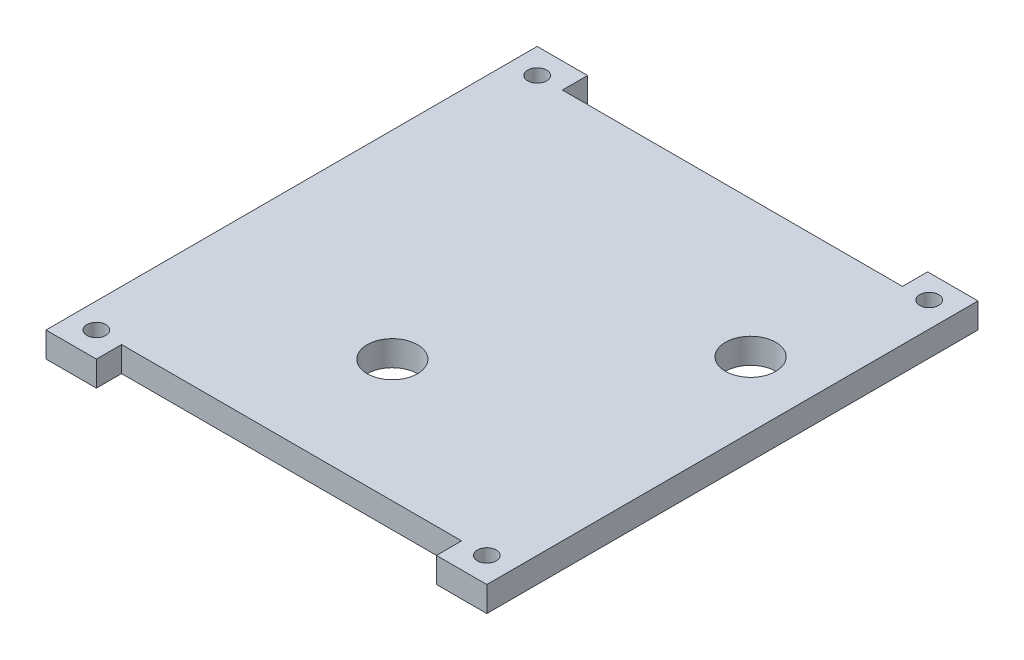
from build123d import *

# Parameters (mm, degrees)
SKETCH1_R           = 0.75
BOSS_EXTRUDE1_DEPTH = 2
SKETCH2_R           = 2
CUT_EXTRUDE1_DEPTH  = 2


with BuildPart() as part:
    # Sketch1 → Boss-Extrude1 (new body)
    with BuildSketch(Plane(origin=(0, 4.390610578, 0), x_dir=(1, 0, 0), z_dir=(0, 1, 0))):
        Polygon((10.961043754, 31.726646364), (10.961043754, -7.273353636), (14.961043754, -7.273353636), (14.961043754, -5.273353636), (41.961043754, -5.273353636), (41.961043754, -7.273353636), (45.961043754, -7.273353636), (45.961043754, 31.726646364), (41.961043754, 31.726646364), (41.961043754, 29.726646364), (14.961043754, 29.726646364), (14.961043754, 31.726646364), align=None)
        with Locations(Location((12.961043754, -5.273353636, 0), (0, 0, 270))):
            Circle(SKETCH1_R, mode=Mode.SUBTRACT)
        with Locations(Location((43.961043754, -5.273353636, 0), (0, 0, 270))):
            Circle(SKETCH1_R, mode=Mode.SUBTRACT)
        with Locations(Location((43.961043754, 29.849185289, 0), (0, 0, 270))):
            Circle(SKETCH1_R, mode=Mode.SUBTRACT)
        with Locations(Location((12.961043754, 29.726646364, 0), (0, 0, 270))):
            Circle(SKETCH1_R, mode=Mode.SUBTRACT)
    extrude(amount=BOSS_EXTRUDE1_DEPTH)

    # Sketch2 → Cut-Extrude1 (cut)
    with BuildSketch(Plane(origin=(0, 6.390610578, 0), x_dir=(1, 0, 0), z_dir=(0, 1, 0))):
        with Locations(Location((26.718170314, 4.468036121, 0), (0, 0, 270))):
            Circle(SKETCH2_R)
        with Locations(Location((40.776506823, 18.857937171, 0), (0, 0, 270))):
            Circle(SKETCH2_R)
    extrude(amount=-CUT_EXTRUDE1_DEPTH, mode=Mode.SUBTRACT)


solid = part.part
